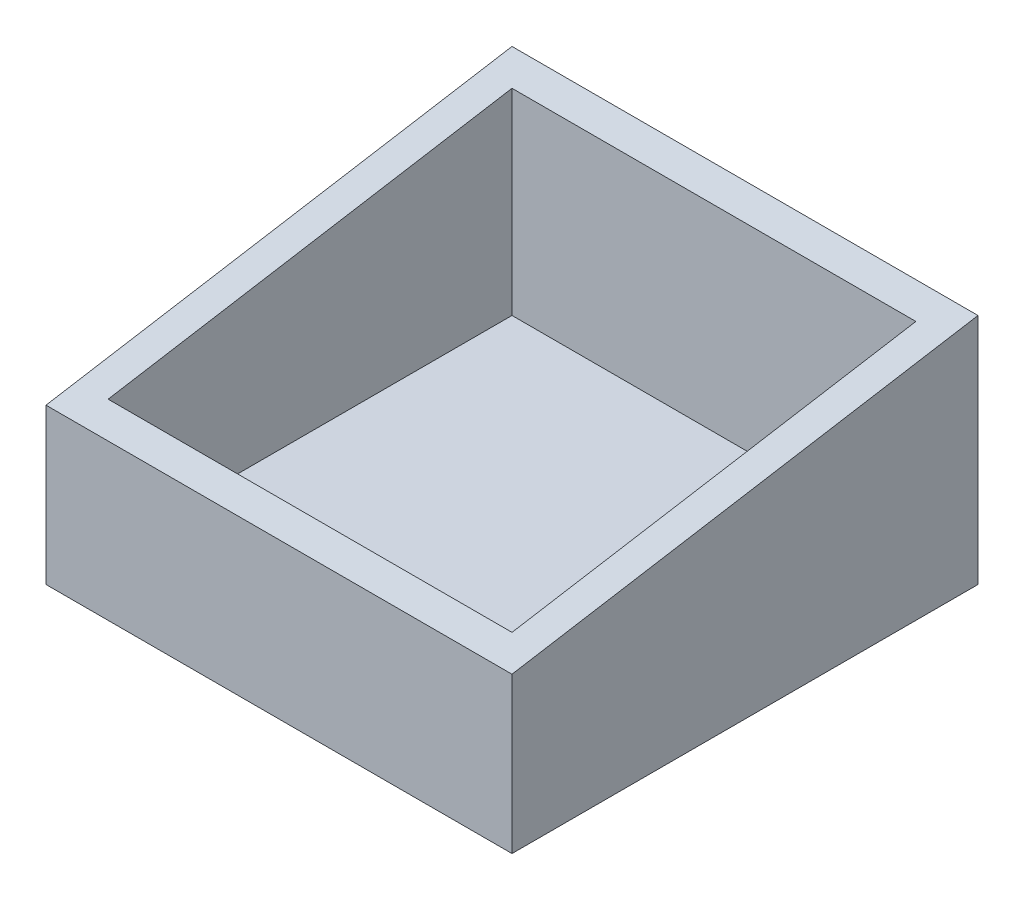
from build123d import *

# Parameters (mm, degrees)
ESQUISSE1_W             = 300
ESQUISSE1_H             = 150
BOSS_EXTRU_1_DEPTH      = 300
ENL_V_MAT_EXTRU_5_DEPTH = 300
COQUE2_T                = -20


with BuildPart() as part:
    # Esquisse1 → Boss.-Extru.1 (new body)
    with BuildSketch(Plane.XY):
        with Locations((150, 75)):
            Rectangle(ESQUISSE1_W, ESQUISSE1_H)
    extrude(amount=BOSS_EXTRU_1_DEPTH)

    # Esquisse5 → Enlèv. mat.-Extru.5 (cut)
    with BuildSketch(Plane(origin=(300, 0, 0), x_dir=(0, 0, -1), z_dir=(1, 0, 0))):
        Polygon((0, 150), (-300, 100), (-300, 150), align=None)
    extrude(amount=-ENL_V_MAT_EXTRU_5_DEPTH, mode=Mode.SUBTRACT)

    # Coque2
    coque2_openings = [part.faces().sort_by_distance(p)[0] for p in [
        (150, 125, 150),
    ]]
    offset(amount=COQUE2_T, openings=coque2_openings, kind=Kind.INTERSECTION)


solid = part.part
